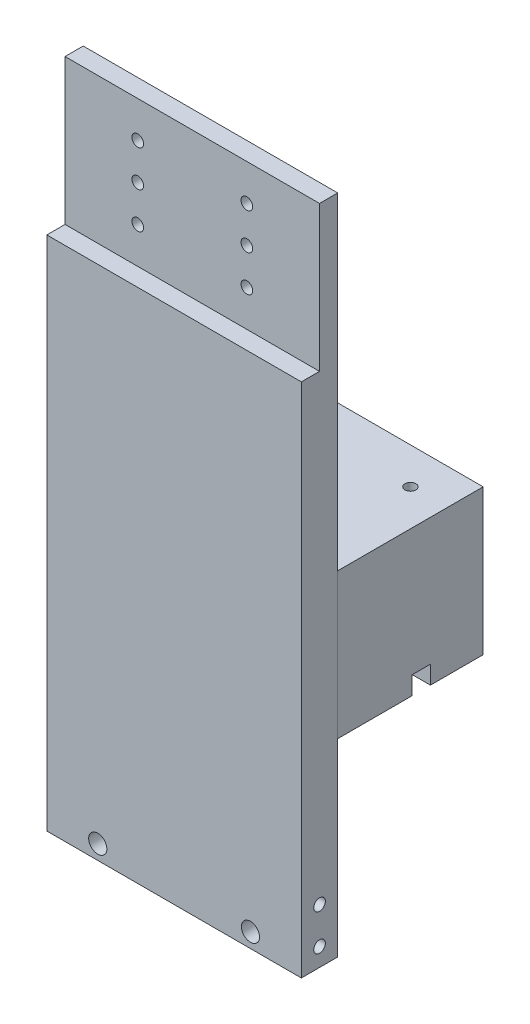
from build123d import *

# Parameters (mm, degrees)
SKETCH_1_W                       = 70
SKETCH_1_H                       = 40
EXTRUDE_1_DEPTH                  = 40
SKETCH_2_R                       = 1.5
CUT_EXTRUDE_1_DEPTH              = 60.579081363
EXTRUDE_2_DEPTH                  = 52
EXTRUDE_2_DEPTH_BACK             = 236
SKETCH_4_W                       = 70
SKETCH_4_H                       = 10
SKETCH_5_R                       = 2.5
CUT_EXTRUDE_2_DEPTH              = 10
SKETCH_6_R                       = 3
CUT_EXTRUDE_3_DEPTH              = 10
SKETCH_7_W                       = 70
SKETCH_7_H                       = 10
EXTRUDE_3_DEPTH                  = 50
SKETCH_8_R                       = 12.5
CUT_EXTRUDE_4_DEPTH              = 10
SKETCH_12_W                      = 39
SKETCH_12_H                      = 39
SKETCH_12_W_2                    = 27
SKETCH_12_H_2                    = 27
EXTRUDE_2_2_DEPTH                = 15
SKETCH_14_R                      = 2
CUT_EXTRUDE_5_DEPTH              = 25
SKETCH_15_W                      = 70
SKETCH_15_H                      = 5
CUT_EXTRUDE_6_DEPTH              = 5
SKETCH_16_W                      = 50
SKETCH_16_H                      = 10
EXTRUDE_5_DEPTH                  = 10
MIRROR_2_COPY_1_SKETCH_W         = 50
MIRROR_2_COPY_1_SKETCH_H         = 10
MIRROR_2_COPY_1_DEPTH            = 10
SKETCH_17_R                      = 2.5
CUT_EXTRUDE_7_DEPTH              = 325.880687163
SKETCH_18_R                      = 2.5
EXTRUDE_6_DEPTH                  = 5
SKETCH_21_W                      = 10
SKETCH_21_H                      = 10
EXTRUDE_8_DEPTH                  = 10
EXTRUDE_9_DEPTH                  = 10
EXTRUDE_10_DEPTH                 = 10
SKETCH_26_R                      = 1.6
CUT_EXTRUDE_8_DEPTH              = 10
SPLIT_BODIES_1_SURFACE_1_BACK    = 338.889
SPLIT_BODIES_1_SURFACE_1_DEPTH   = 677.778
SPLIT_BODIES_1_SURFACE_2_BACK    = 338.889
SPLIT_BODIES_1_SURFACE_2_DEPTH   = 677.778
SKETCH_27_R                      = 1.6
CUT_EXTRUDE_9_DEPTH              = 175.033009856
SPLIT_BODIES_2_SURFACE_1_3_BACK  = 223.09
SPLIT_BODIES_2_SURFACE_1_3_DEPTH = 446.18
SPLIT_BODIES_2_SURFACE_1_4_BACK  = 223.09
SPLIT_BODIES_2_SURFACE_1_4_DEPTH = 446.18
SPLIT_BODIES_2_SURFACE_2_5_BACK  = 223.09
SPLIT_BODIES_2_SURFACE_2_5_DEPTH = 446.18
SPLIT_BODIES_2_SURFACE_2_6_BACK  = 223.09
SPLIT_BODIES_2_SURFACE_2_6_DEPTH = 446.18


with BuildPart() as part:
    # 草图1 → 凸台-拉伸1 (new body)
    with BuildSketch(Plane(origin=(0, 0, 0), x_dir=(1, 0, 0), z_dir=(0, 1, 0))):
        with Locations((2.864103165, -2.71511892)):
            Rectangle(SKETCH_1_W, SKETCH_1_H)
    extrude(amount=EXTRUDE_1_DEPTH)

    # 草图2 → 切除-拉伸1 (cut, through all)
    with BuildSketch(Plane.XZ):
        with Locations(Location((-22.135896835, 17.71511892, 0), (0, 0, 270))):
            Circle(SKETCH_2_R)
        with Locations(Location((27.864103165, 17.71511892, 0), (0, 0, 90))):
            Circle(SKETCH_2_R)
        with Locations(Location((-22.135896835, -7.28488108, 0), (0, 0, 270))):
            Circle(SKETCH_2_R)
        with Locations(Location((27.864103165, -7.28488108, 0), (0, 0, 90))):
            Circle(SKETCH_2_R)
    extrude(amount=-CUT_EXTRUDE_1_DEPTH, mode=Mode.SUBTRACT)

    # 草图15 → 切除-拉伸6 (cut)
    with BuildSketch(Plane.XZ):
        with Locations((2.864103165, -0.28488108)):
            Rectangle(SKETCH_15_W, SKETCH_15_H)
    extrude(amount=-CUT_EXTRUDE_6_DEPTH, mode=Mode.SUBTRACT)


with BuildPart() as body_2:
    # 草图4 → Extrude 2 (new, two sides: drawn at the far end of the back side and taken through both)
    with BuildSketch(Plane.XZ.offset(-EXTRUDE_2_DEPTH_BACK)):
        with Locations((2.864103165, 27.71511892)):
            Rectangle(SKETCH_4_W, SKETCH_4_H)
    extrude(amount=EXTRUDE_2_DEPTH + EXTRUDE_2_DEPTH_BACK)

    # 草图5 → 切除-拉伸2 (cut)
    with BuildSketch(Plane.XY.offset(32.71511892)):
        with Locations((-18.135896835, -48)):
            Circle(SKETCH_5_R)
        with Locations(Location((23.864103165, -48, 0), (0, 0, 180))):
            Circle(SKETCH_5_R)
    extrude(amount=-CUT_EXTRUDE_2_DEPTH, mode=Mode.SUBTRACT)

    # 草图6 → 切除-拉伸3 (cut)
    with BuildSketch(Plane.XY.offset(32.71511892)):
        with Locations((-18.135896835, 212)):
            Circle(SKETCH_6_R)
        with Locations(Location((23.864103165, 212, 0), (0, 0, 180))):
            Circle(SKETCH_6_R)
    extrude(amount=-CUT_EXTRUDE_3_DEPTH, mode=Mode.SUBTRACT)

    # 草图7 → 凸台-拉伸3 (add)
    with BuildSketch(Plane(origin=(0, 0, 22.71511892), x_dir=(-1, 0, 0), z_dir=(0, 0, -1))):
        with Locations((-2.864103165, 241)):
            Rectangle(SKETCH_7_W, SKETCH_7_H)
    extrude(amount=-EXTRUDE_3_DEPTH)

    # 草图8 → 切除-拉伸4 (cut)
    with BuildSketch(Plane.XZ.offset(-236)):
        with Locations(Location((2.864103165, 52.71511892, 0), (0, 0, 270))):
            Circle(SKETCH_8_R)
    extrude(amount=-CUT_EXTRUDE_4_DEPTH, mode=Mode.SUBTRACT)

    # 草图12 → Extrude 2 2 (add)
    with BuildSketch(Plane(origin=(0, 246, 0), x_dir=(1, 0, 0), z_dir=(0, 1, 0))):
        with Locations((2.864103165, -52.71511892)):
            Rectangle(SKETCH_12_W, SKETCH_12_H)
        with Locations((2.864103165, -52.71511892)):
            Rectangle(SKETCH_12_W_2, SKETCH_12_H_2, mode=Mode.SUBTRACT)
    extrude(amount=EXTRUDE_2_2_DEPTH)

    # 草图14 → 切除-拉伸5 (cut)
    with BuildSketch(Plane(origin=(0, 261, 0), x_dir=(1, 0, 0), z_dir=(0, 1, 0))):
        with Locations(Location((-12.635896835, -37.21511892, 0), (0, 0, 270))):
            Circle(SKETCH_14_R)
        with Locations(Location((18.364103165, -37.21511892, 0), (0, 0, 90))):
            Circle(SKETCH_14_R)
        with Locations(Location((-12.635896835, -68.21511892, 0), (0, 0, 90))):
            Circle(SKETCH_14_R)
        with Locations(Location((18.364103165, -68.21511892, 0), (0, 0, 270))):
            Circle(SKETCH_14_R)
    extrude(amount=-CUT_EXTRUDE_5_DEPTH, mode=Mode.SUBTRACT)

    # 草图16 → 凸台-拉伸5 (add)
    with BuildSketch(Plane.ZY.offset(32.135896835)):
        with Locations((47.71511892, 241)):
            Rectangle(SKETCH_16_W, SKETCH_16_H)
    extrude_5 = extrude(amount=EXTRUDE_5_DEPTH)

    # 镜向1: 凸台-拉伸5 across plane
    add(extrude_5.mirror(Plane.ZX.offset(97)))

    # 镜向2: 凸台-拉伸5 across plane
    add(extrude_5.mirror(Plane.ZY.offset(-2.864103165)))

    # 镜向2 copy 1 sketch → 镜向2 copy 1 (add)
    with BuildSketch(Plane(origin=(37.864103165, 194, 0), x_dir=(0, 0, 1), z_dir=(1, 0, 0))):
        with Locations((47.71511892, 241)):
            Rectangle(MIRROR_2_COPY_1_SKETCH_W, MIRROR_2_COPY_1_SKETCH_H)
    extrude(amount=MIRROR_2_COPY_1_DEPTH)

    # 草图17 → 切除-拉伸7 (cut, through all)
    with BuildSketch(Plane.XZ.offset(52)):
        with Locations(Location((-37.135896835, 52.71511892, 0), (0, 0, 270))):
            Circle(SKETCH_17_R)
        with Locations(Location((42.864103165, 52.71511892, 0), (0, 0, 270))):
            Circle(SKETCH_17_R)
    extrude(amount=-CUT_EXTRUDE_7_DEPTH, mode=Mode.SUBTRACT)

    # 草图18 → 凸台-拉伸6 (add)
    with BuildSketch(Plane.XZ.offset(52)):
        with Locations(Location((-37.135896835, 52.71511892, 0), (0, 0, 270))):
            Circle(SKETCH_18_R)
        with Locations(Location((42.864103165, 52.71511892, 0), (0, 0, 270))):
            Circle(SKETCH_18_R)
    extrude(amount=-EXTRUDE_6_DEPTH)

    # 草图21 → 凸台-拉伸8 (add)
    with BuildSketch(Plane(origin=(0, 0, 22.71511892), x_dir=(-1, 0, 0), z_dir=(0, 0, -1))):
        with Locations((-42.864103165, -37)):
            Rectangle(SKETCH_21_W, SKETCH_21_H)
    extrude_8 = extrude(amount=-EXTRUDE_8_DEPTH)

    # 镜向3: 凸台-拉伸8 across plane
    add(extrude_8.mirror(Plane.ZY.offset(-2.864103165)))

    # 草图22 → 凸台-拉伸9 (add)
    with BuildSketch(Plane(origin=(47.864103165, 0, 0), x_dir=(0, 0, -1), z_dir=(1, 0, 0))):
        Polygon((-32.71511892, -32), (-42.71511892, -42), (-32.71511892, -42), align=None)
    extrude(amount=-EXTRUDE_9_DEPTH)

    # 草图23 → 凸台-拉伸10 (add)
    with BuildSketch(Plane.ZY.offset(42.135896835)):
        Polygon((32.71511892, -32), (42.71511892, -42), (32.71511892, -42), align=None)
    extrude(amount=-EXTRUDE_10_DEPTH)

    # 草图26 → 切除-拉伸8 (cut)
    with BuildSketch(Plane(origin=(0, 0, 22.71511892), x_dir=(-1, 0, 0), z_dir=(0, 0, -1))):
        with Locations((-17.864103165, 100)):
            Circle(SKETCH_26_R)
        with Locations((-17.864103165, 110)):
            Circle(SKETCH_26_R)
        with Locations((-17.864103165, 120)):
            Circle(SKETCH_26_R)
        with Locations((12.135896835, 120)):
            Circle(SKETCH_26_R)
        with Locations((12.135896835, 110)):
            Circle(SKETCH_26_R)
        with Locations((12.135896835, 100)):
            Circle(SKETCH_26_R)
    extrude(amount=-CUT_EXTRUDE_8_DEPTH, mode=Mode.SUBTRACT)


with BuildPart() as body_3:
    # Split Bodies 1: the piece behind the surface
    add(body_2.part)
    # Split Bodies 1 surface: a surface, the sketch's curves swept straight by 677.778 mm
    with BuildLine(Plane.ZY.offset(32.135896835).offset(-SPLIT_BODIES_1_SURFACE_1_BACK), mode=Mode.PRIVATE) as split_bodies_1_surface_1_path:
        Line((22.71511892, 130), (27.71511892, 130))
        Line((27.71511892, 130), (27.71511892, 90))
        Line((27.71511892, 90), (32.71511892, 90))
    split_bodies_1_surface_1 = Shell.extrude(split_bodies_1_surface_1_path.wire(), (-1 * SPLIT_BODIES_1_SURFACE_1_DEPTH, 0 * SPLIT_BODIES_1_SURFACE_1_DEPTH, 0 * SPLIT_BODIES_1_SURFACE_1_DEPTH))
    split(bisect_by=split_bodies_1_surface_1, keep=Keep.BOTTOM)

    # 草图27 → 切除-拉伸9 (cut, through all)
    with BuildSketch(Plane.ZY.offset(42.135896835)):
        with Locations((27.71511892, -37)):
            Circle(SKETCH_27_R)
        with Locations((27.71511892, -47)):
            Circle(SKETCH_27_R)
    extrude(amount=-CUT_EXTRUDE_9_DEPTH, mode=Mode.SUBTRACT)


with BuildPart() as body_2_1:
    add(body_2.part)

    # Split Bodies 1: split by a surface, the side it looks to stays
    # Split Bodies 1 surface: a surface, the sketch's curves swept straight by 677.778 mm
    with BuildLine(Plane.ZY.offset(32.135896835).offset(-SPLIT_BODIES_1_SURFACE_2_BACK), mode=Mode.PRIVATE) as split_bodies_1_surface_2_path:
        Line((22.71511892, 130), (27.71511892, 130))
        Line((27.71511892, 130), (27.71511892, 90))
        Line((27.71511892, 90), (32.71511892, 90))
    split_bodies_1_surface_2 = Shell.extrude(split_bodies_1_surface_2_path.wire(), (-1 * SPLIT_BODIES_1_SURFACE_2_DEPTH, 0 * SPLIT_BODIES_1_SURFACE_2_DEPTH, 0 * SPLIT_BODIES_1_SURFACE_2_DEPTH))
    split(bisect_by=split_bodies_1_surface_2, keep=Keep.TOP)


with BuildPart() as body_3_2:
    # Split Bodies 2: the piece behind the surface
    add(body_3.part)
    # Split Bodies 2 surface 1: a surface, the sketch's curves swept straight by 446.18 mm
    with BuildLine(Plane(origin=(0, 0, 22.71511892), x_dir=(-1, 0, 0), z_dir=(0, 0, -1)).offset(-SPLIT_BODIES_2_SURFACE_1_3_BACK), mode=Mode.PRIVATE) as split_bodies_2_surface_1_3_path:
        Line((-37.864103165, -32), (-37.864103165, -52))
    split_bodies_2_surface_1_3 = Shell.extrude(split_bodies_2_surface_1_3_path.wire(), (0 * SPLIT_BODIES_2_SURFACE_1_3_DEPTH, 0 * SPLIT_BODIES_2_SURFACE_1_3_DEPTH, -1 * SPLIT_BODIES_2_SURFACE_1_3_DEPTH))
    split(bisect_by=split_bodies_2_surface_1_3, keep=Keep.BOTTOM)


with BuildPart() as body_3_1:
    add(body_3.part)

    # Split Bodies 2: split by a surface, the side it looks to stays
    # Split Bodies 2 surface 1: a surface, the sketch's curves swept straight by 446.18 mm
    with BuildLine(Plane(origin=(0, 0, 22.71511892), x_dir=(-1, 0, 0), z_dir=(0, 0, -1)).offset(-SPLIT_BODIES_2_SURFACE_1_4_BACK), mode=Mode.PRIVATE) as split_bodies_2_surface_1_4_path:
        Line((-37.864103165, -32), (-37.864103165, -52))
    split_bodies_2_surface_1_4 = Shell.extrude(split_bodies_2_surface_1_4_path.wire(), (0 * SPLIT_BODIES_2_SURFACE_1_4_DEPTH, 0 * SPLIT_BODIES_2_SURFACE_1_4_DEPTH, -1 * SPLIT_BODIES_2_SURFACE_1_4_DEPTH))
    split(bisect_by=split_bodies_2_surface_1_4, keep=Keep.TOP)


with BuildPart() as body_4:
    # Split Bodies 2 2: the piece behind the surface
    add(body_3_1.part)
    # Split Bodies 2 surface 2: a surface, the sketch's curves swept straight by 446.18 mm
    with BuildLine(Plane(origin=(0, 0, 22.71511892), x_dir=(-1, 0, 0), z_dir=(0, 0, -1)).offset(-SPLIT_BODIES_2_SURFACE_2_5_BACK), mode=Mode.PRIVATE) as split_bodies_2_surface_2_5_path:
        Line((32.135896835, -32), (32.135896835, -52))
    split_bodies_2_surface_2_5 = Shell.extrude(split_bodies_2_surface_2_5_path.wire(), (0 * SPLIT_BODIES_2_SURFACE_2_5_DEPTH, 0 * SPLIT_BODIES_2_SURFACE_2_5_DEPTH, -1 * SPLIT_BODIES_2_SURFACE_2_5_DEPTH))
    split(bisect_by=split_bodies_2_surface_2_5, keep=Keep.BOTTOM)


with BuildPart() as body_3_3:
    add(body_3_1.part)

    # Split Bodies 2 2: split by a surface, the side it looks to stays
    # Split Bodies 2 surface 2: a surface, the sketch's curves swept straight by 446.18 mm
    with BuildLine(Plane(origin=(0, 0, 22.71511892), x_dir=(-1, 0, 0), z_dir=(0, 0, -1)).offset(-SPLIT_BODIES_2_SURFACE_2_6_BACK), mode=Mode.PRIVATE) as split_bodies_2_surface_2_6_path:
        Line((32.135896835, -32), (32.135896835, -52))
    split_bodies_2_surface_2_6 = Shell.extrude(split_bodies_2_surface_2_6_path.wire(), (0 * SPLIT_BODIES_2_SURFACE_2_6_DEPTH, 0 * SPLIT_BODIES_2_SURFACE_2_6_DEPTH, -1 * SPLIT_BODIES_2_SURFACE_2_6_DEPTH))
    split(bisect_by=split_bodies_2_surface_2_6, keep=Keep.TOP)


solid = Compound([part.part, body_4.part])
